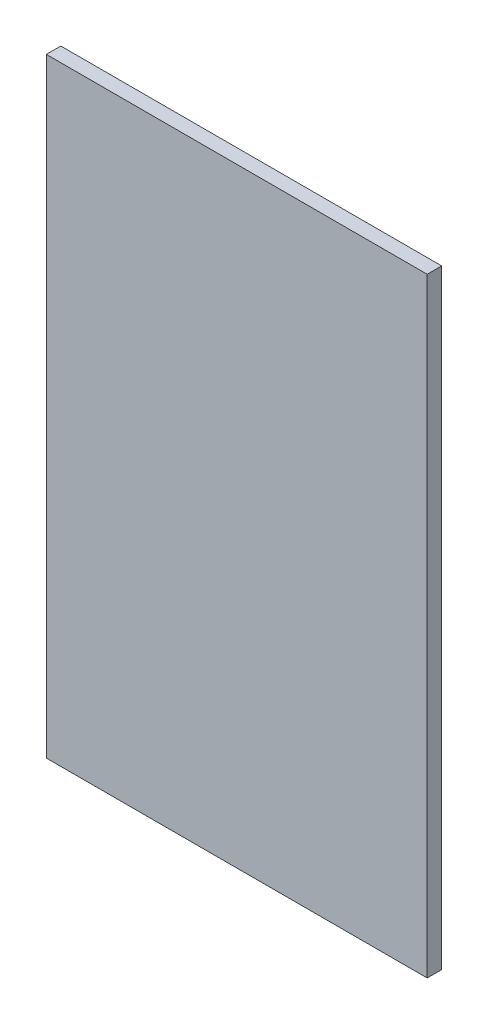
from build123d import *

# Parameters (mm, degrees)
ESQUISSE1_W        = 500
ESQUISSE1_H        = 800
BOSS_EXTRU_1_DEPTH = 19


with BuildPart() as part:
    # Esquisse1 → Boss.-Extru.1 (new body)
    with BuildSketch(Plane.XY):
        with Locations((250, 400)):
            Rectangle(ESQUISSE1_W, ESQUISSE1_H)
    extrude(amount=BOSS_EXTRU_1_DEPTH)


solid = part.part
